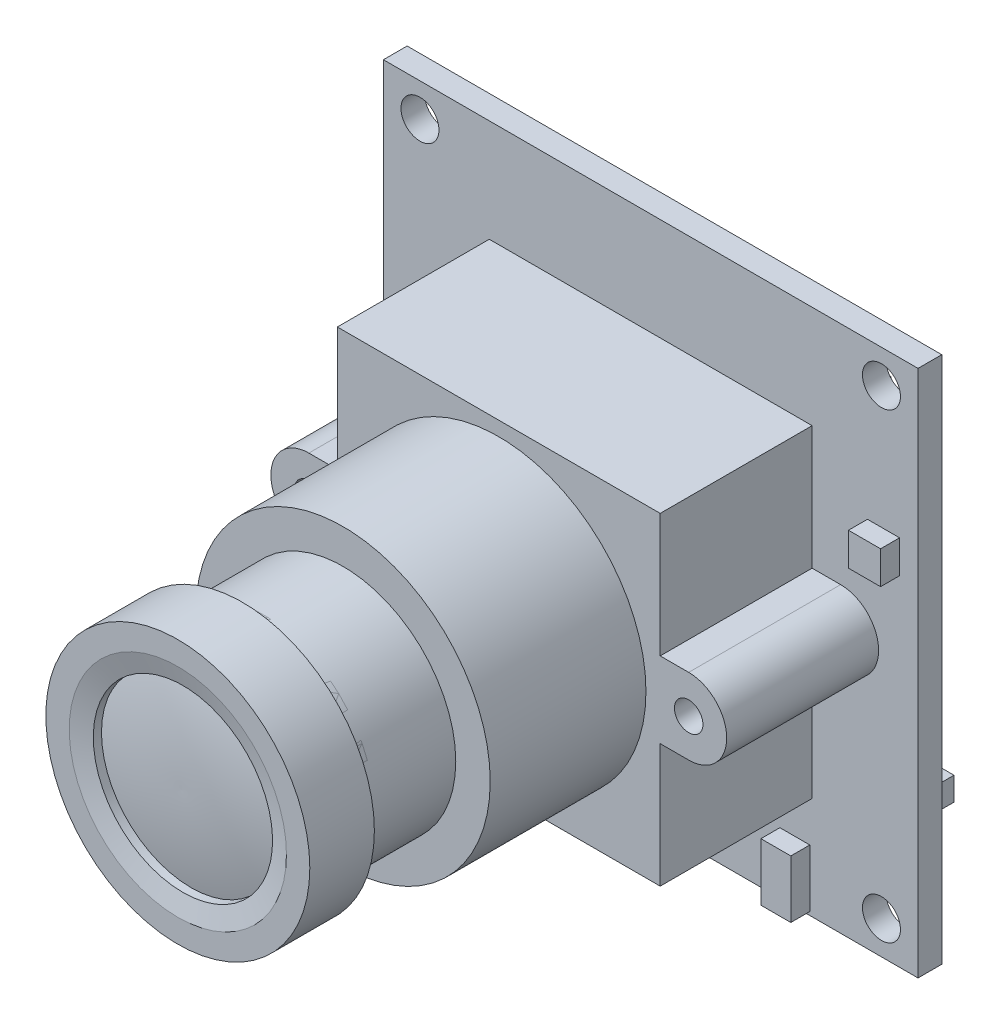
from build123d import *

# Parameters (mm, degrees)
SKETCH1_W              = 28.15
SKETCH1_H              = 27.8
BASE_SHAPE_DEPTH       = 1.25
MOUNTING_HOLES_REACH   = 21.821
SKETCH2_R              = 1
SKETCH3_R              = 0.75
CAM_BASE_DEPTH         = 8
SKETCH4_R              = 7.75
CAM_STEP_1_DEPTH       = 8.2
SKETCH5_R              = 5.935
CAM_STEP_2_DEPTH       = 5.3
SKETCH6_R              = 6.95
CAM_STEP_3_DEPTH       = 3.4
LENS_CHAMFER_SIZE      = 1
LENS_CHAMFER_SIZE2     = 0.267949192
SKETCH8_R              = 5.935
LENS_BACKGROUND_DEPTH  = 1
SKETCH9_W              = 2.805155133
SKETCH9_H              = 4.188519308
SKETCH9_W_2            = 1.575498088
SKETCH9_H_2            = 3.035715829
SKETCH9_W_3            = 1.690778436
SKETCH9_H_3            = 1.729205218
FRONT_COMPONENTS_DEPTH = 1
SKETCH10_R             = 1.720644744
SKETCH10_R_2           = 1.698620275
SKETCH10_W             = 5.110762091
SKETCH10_H             = 4.764921047
SKETCH10_W_2           = 1.575498088
SKETCH10_H_2           = 1.46021774
SKETCH10_W_3           = 1.690778437
SKETCH10_H_3           = 1.229657045
SKETCH10_W_4           = 1.46021774
SKETCH10_H_4           = 2.728301567
SKETCH10_W_5           = 1.421790957
SKETCH10_H_5           = 1.268083827
SKETCH10_W_6           = 1.537071306
SKETCH10_H_6           = 2.843581915
SKETCH10_W_7           = 2.805155133
SKETCH10_H_7           = 1.690778436
SKETCH10_W_8           = 2.728301568
SKETCH10_H_8           = 1.306510609
SKETCH10_W_9           = 1.537071305
SKETCH10_H_9           = 1.421790958
SKETCH10_W_10          = 6.99367444
SKETCH10_H_10          = 6.724686962
REAR_COMPONENTS_DEPTH  = 1.5
SKETCH11_W             = 10
SKETCH11_H             = 3.3
BOSS_EXTRUDE9_DEPTH    = 4.8
SKETCH12_W             = 3.25
SKETCH12_H             = 2.5
SKETCH12_W_2           = 4.7
CUT_EXTRUDE2_DEPTH     = 4.4
SKETCH13_W             = 3.25
SKETCH13_H             = 1.6
SKETCH13_W_2           = 4.7
CUT_EXTRUDE3_DEPTH     = 0.4


with BuildPart() as part:
    # Sketch1 → Base shape (new body)
    with BuildSketch(Plane.XY):
        Rectangle(SKETCH1_W, SKETCH1_H)
    extrude(amount=BASE_SHAPE_DEPTH)

    # Sketch2 → Mounting holes (cut, up to next)
    with BuildSketch(Plane.XY.offset(1.25), mode=Mode.PRIVATE) as mounting_holes_sk1:
        with Locations((12.15, 12.15)):
            Circle(SKETCH2_R)
    mounting_holes_tool1 = extrude(mounting_holes_sk1.sketch, amount=-MOUNTING_HOLES_REACH, mode=Mode.PRIVATE) & part.part
    # Sketch2 → Mounting holes (cut, up to next)
    with BuildSketch(Plane.XY.offset(1.25), mode=Mode.PRIVATE) as mounting_holes_sk2:
        with Locations((-12.15, 12.15)):
            Circle(SKETCH2_R)
    mounting_holes_tool2 = extrude(mounting_holes_sk2.sketch, amount=-MOUNTING_HOLES_REACH, mode=Mode.PRIVATE) & part.part
    # Sketch2 → Mounting holes (cut, up to next)
    with BuildSketch(Plane.XY.offset(1.25), mode=Mode.PRIVATE) as mounting_holes_sk3:
        with Locations((12.15, -12.15)):
            Circle(SKETCH2_R)
    mounting_holes_tool3 = extrude(mounting_holes_sk3.sketch, amount=-MOUNTING_HOLES_REACH, mode=Mode.PRIVATE) & part.part
    # Sketch2 → Mounting holes (cut, up to next)
    with BuildSketch(Plane.XY.offset(1.25), mode=Mode.PRIVATE) as mounting_holes_sk4:
        with Locations((-12.15, -12.15)):
            Circle(SKETCH2_R)
    mounting_holes_tool4 = extrude(mounting_holes_sk4.sketch, amount=-MOUNTING_HOLES_REACH, mode=Mode.PRIVATE) & part.part
    add(mounting_holes_tool1.solids().sort_by_distance((12.15, 12.15, 1.25))[0], mode=Mode.SUBTRACT)
    add(mounting_holes_tool2.solids().sort_by_distance((-12.15, 12.15, 1.25))[0], mode=Mode.SUBTRACT)
    add(mounting_holes_tool3.solids().sort_by_distance((12.15, -12.15, 1.25))[0], mode=Mode.SUBTRACT)
    add(mounting_holes_tool4.solids().sort_by_distance((-12.15, -12.15, 1.25))[0], mode=Mode.SUBTRACT)

    # Sketch3 → Cam base (add)
    with BuildSketch(Plane.XY.offset(1.25)):
        with BuildLine():
            Line((8.5, -8.5), (8.5, -2))
            Line((8.5, -2), (10, -2))
            ThreePointArc((10, -2), (12, 0), (10, 2))
            Line((10, 2), (8.5, 2))
            Line((8.5, 2), (8.5, 8.5))
            Line((8.5, 8.5), (-8.5, 8.5))
            Line((-8.5, 8.5), (-8.5, 2))
            Line((-8.5, 2), (-10, 2))
            ThreePointArc((-10, 2), (-12, 0), (-10, -2))
            Line((-10, -2), (-8.5, -2))
            Line((-8.5, -2), (-8.5, -8.5))
            Line((-8.5, -8.5), (8.5, -8.5))
        make_face()
        with Locations((-10, 0)):
            Circle(SKETCH3_R, mode=Mode.SUBTRACT)
        with Locations((10, 0)):
            Circle(SKETCH3_R, mode=Mode.SUBTRACT)
    extrude(amount=CAM_BASE_DEPTH)

    # Sketch4 → Cam step 1 (add)
    with BuildSketch(Plane.XY.offset(9.25)):
        Circle(SKETCH4_R)
    extrude(amount=CAM_STEP_1_DEPTH)

    # Sketch5 → Cam step 2 (add)
    with BuildSketch(Plane.XY.offset(17.45)):
        Circle(SKETCH5_R)
    extrude(amount=CAM_STEP_2_DEPTH)

    # Sketch6 → Cam step 3 (add)
    with BuildSketch(Plane.XY.offset(22.75)):
        Circle(SKETCH6_R)
    extrude(amount=CAM_STEP_3_DEPTH)

    # Sketch7 → Lens profile (revolve, cut)
    with BuildSketch(Plane(origin=(0, 0, 0), x_dir=(0, 0, -1), z_dir=(1, 0, 0)), mode=Mode.PRIVATE) as lens_profile_sk:
        with BuildLine():
            Line((-25.45, 4.72), (-26.15, 4.72))
            Line((-26.15, 4.72), (-26.15, 0))
            Line((-26.15, 0), (-25.95, 0))
            add(Edge.make_bspline(
                [(-25.95, 0), (-25.99669702, 2.391304703), (-25.45, 4.72)],
                knots=[0, 0, 0, 1, 1, 1], degree=2))
        make_face()
    revolve(lens_profile_sk.sketch.rotate(Axis((0, 0, 26.15), (0, 0, -1)), 180), axis=Axis((0, 0, 26.15), (0, 0, -1)), mode=Mode.SUBTRACT)

    # Lens chamfer
    lens_chamfer_edges = [part.edges().sort_by_distance(p)[0] for p in [
        (0, 4.72, 26.15),
    ]]
    lens_chamfer_side = [part.faces().sort_by_distance(p)[0] for p in [
        (-6.753424315, 0, 26.15),
    ]]
    chamfer(lens_chamfer_edges, length=LENS_CHAMFER_SIZE, length2=LENS_CHAMFER_SIZE2, reference=lens_chamfer_side[0])

    # Sketch9 → Front components (add)
    with BuildSketch(Plane.XY.offset(1.25)):
        with Locations((-11.893089227, -6.321205744)):
            Rectangle(SKETCH9_W, SKETCH9_H)
        with Locations((7.589289571, -12.200503488)):
            Rectangle(SKETCH9_W_2, SKETCH9_H_2)
        with Locations((12.258143662, 4.822561221)):
            Rectangle(SKETCH9_W_3, SKETCH9_H_3)
    extrude(amount=FRONT_COMPONENTS_DEPTH)

    # Sketch10 → Rear components (add)
    with BuildSketch(Plane(origin=(0, 0, 0), x_dir=(-1, 0, 0), z_dir=(0, 0, -1))):
        with Locations(Location((-8.569172528, -6.647833396, 0), (0, 0, 180))):
            Circle(SKETCH10_R)
        with Locations(Location((-4.22694609, -8.377038615, 0), (0, 0, 180))):
            Circle(SKETCH10_R_2)
        with Locations((-7.358728876, 7.685356527)):
            Rectangle(SKETCH10_W, SKETCH10_H)
        with Locations((-6.782327136, 1.383364175)):
            Rectangle(SKETCH10_W_2, SKETCH10_H_2)
        with Locations((-12.37342401, -7.070528005)):
            Rectangle(SKETCH10_W_3, SKETCH10_H_3)
        with Locations((-8.261758267, -10.740285747)):
            Rectangle(SKETCH10_W_4, SKETCH10_H_4)
        with Locations((-4.015598785, -5.283682612)):
            Rectangle(SKETCH10_W_5, SKETCH10_H_5)
        with Locations((0.73010887, -7.032101223)):
            Rectangle(SKETCH10_W_6, SKETCH10_H_6)
        with Locations((11.777808879, -4.80334783)):
            Rectangle(SKETCH10_W_7, SKETCH10_H_7)
        with Locations((12.277357053, 2.805155133)):
            Rectangle(SKETCH10_W_8, SKETCH10_H_8)
        with Locations((8.453892181, -9.702762616)):
            Rectangle(SKETCH10_W_9, SKETCH10_H_9)
        with Locations((2.76672835, 5.82165757)):
            Rectangle(SKETCH10_W_10, SKETCH10_H_10)
    extrude(amount=REAR_COMPONENTS_DEPTH)


with BuildPart() as body_2:
    # Sketch8 → Lens background (new body)
    with BuildSketch(Plane(origin=(0, 0, 22.75), x_dir=(-1, 0, 0), z_dir=(0, 0, -1))):
        Circle(SKETCH8_R)
    extrude(amount=LENS_BACKGROUND_DEPTH)


with BuildPart() as body_3:
    # Sketch11 → Boss-Extrude9 (new body)
    with BuildSketch(Plane(origin=(0, 0, 0), x_dir=(-1, 0, 0), z_dir=(0, 0, -1))):
        with Locations((5.475, -12.25)):
            Rectangle(SKETCH11_W, SKETCH11_H)
    extrude(amount=BOSS_EXTRUDE9_DEPTH)

    # Sketch12 → Cut-Extrude2 (cut)
    with BuildSketch(Plane(origin=(0, 0, -4.8), x_dir=(-1, 0, 0), z_dir=(0, 0, -1))):
        with Locations((2.5, -12.25)):
            Rectangle(SKETCH12_W, SKETCH12_H)
        with Locations((7.725, -12.25)):
            Rectangle(SKETCH12_W_2, SKETCH12_H)
    extrude(amount=-CUT_EXTRUDE2_DEPTH, mode=Mode.SUBTRACT)

    # Sketch13 → Cut-Extrude3 (cut)
    with BuildSketch(Plane(origin=(0, -10.6, 0), x_dir=(1, 0, 0), z_dir=(0, 1, 0))):
        with Locations((-2.5, 4)):
            Rectangle(SKETCH13_W, SKETCH13_H)
        with Locations((-7.725, 4)):
            Rectangle(SKETCH13_W_2, SKETCH13_H)
    extrude(amount=-CUT_EXTRUDE3_DEPTH, mode=Mode.SUBTRACT)


solid = Compound([part.part, body_2.part, body_3.part])
